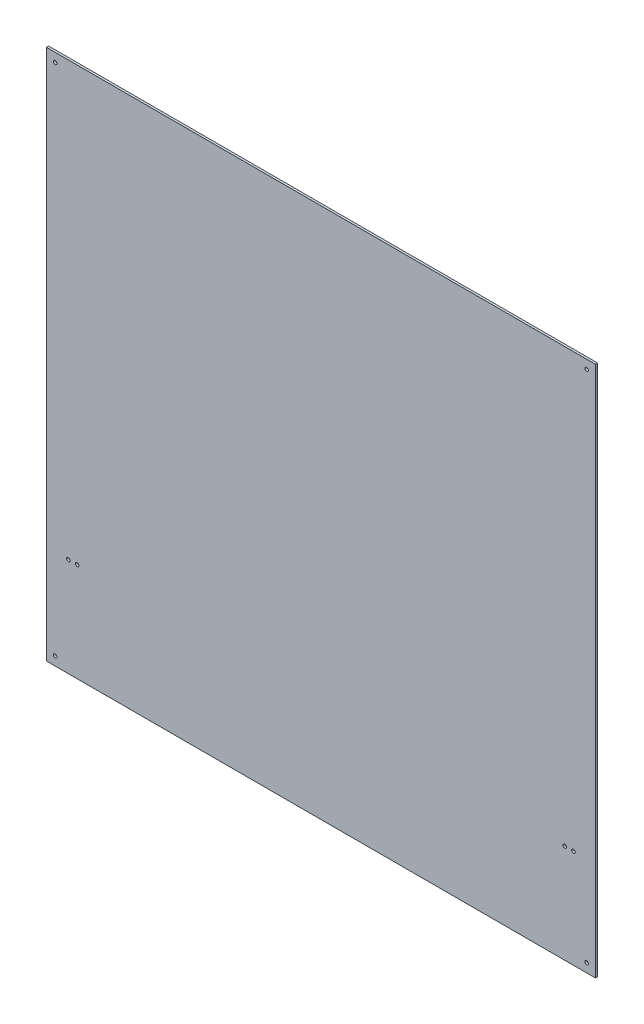
from build123d import *

# Parameters (mm, degrees)
SKETCH_1_W          = 1250
SKETCH_1_H          = 1210
EXTRUDE_1_DEPTH     = 5
SKETCH_2_R          = 4.05
CUT_EXTRUDE_1_DEPTH = 5
SKETCH_3_R          = 4.05
CUT_EXTRUDE_2_DEPTH = 5


with BuildPart() as part:
    # 草图1 → 凸台-拉伸1 (new body)
    with BuildSketch(Plane.XY):
        with Locations((-28.566371681, -50.327433628)):
            Rectangle(SKETCH_1_W, SKETCH_1_H)
    extrude(amount=EXTRUDE_1_DEPTH)

    # 草图2 → 切除-拉伸1 (cut)
    with BuildSketch(Plane.XY.offset(5)):
        with Locations((-633.566371681, 534.672566372)):
            Circle(SKETCH_2_R)
        with Locations((576.433628319, 534.672566372)):
            Circle(SKETCH_2_R)
        with Locations((576.433628319, -635.327433628)):
            Circle(SKETCH_2_R)
        with Locations((-633.566371681, -635.327433628)):
            Circle(SKETCH_2_R)
    extrude(amount=-CUT_EXTRUDE_1_DEPTH, mode=Mode.SUBTRACT)

    # 草图3 → 切除-拉伸2 (cut)
    with BuildSketch(Plane.XY.offset(5)):
        with Locations((-603.566371681, -430.327433628)):
            Circle(SKETCH_3_R)
        with Locations((526.433628319, -430.327433628)):
            Circle(SKETCH_3_R)
        with Locations((-583.566371681, -430.327433628)):
            Circle(SKETCH_3_R)
        with Locations((546.433628319, -430.327433628)):
            Circle(SKETCH_3_R)
    extrude(amount=-CUT_EXTRUDE_2_DEPTH, mode=Mode.SUBTRACT)


solid = part.part
